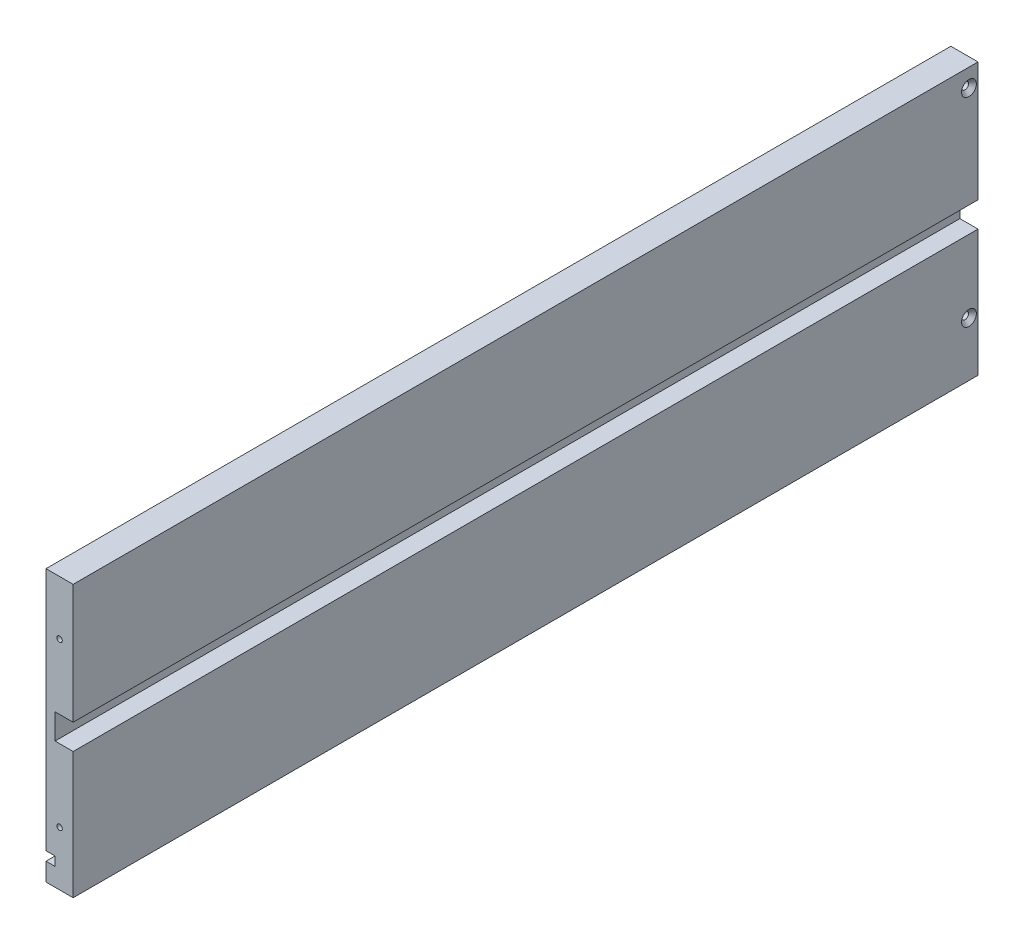
from build123d import *

# Parameters (mm, degrees)
SKETCH2_W                                         = 500
SKETCH2_H                                         = 150
BASE_EXTRUDE_DEPTH                                = 15
SKETCH3_W                                         = 10
SKETCH3_H                                         = 14
CUT_EXTRUDE1_DEPTH                                = 523.230791892
SKETCH4_W                                         = 5
SKETCH4_H                                         = 5
CUT_EXTRUDE2_DEPTH                                = 523.230791892
CSK_FOR_M3_5_FLAT_HEAD_MACHINE_SCREW1_D           = 3.9
CSK_FOR_M3_5_FLAT_HEAD_MACHINE_SCREW1_CSINK_D     = 8.2
CSK_FOR_M3_5_FLAT_HEAD_MACHINE_SCREW1_CSINK_ANGLE = 90
M3_0_3_000000_DIAMETER_HOLE1_D                    = 3
M3_0_3_000000_DIAMETER_HOLE1_DEPTH                = 10
M3_0_3_000000_DIAMETER_HOLE1_TIP                  = 0.901290929


with BuildPart() as part:
    # Sketch2 → Base-Extrude (new body)
    with BuildSketch(Plane(origin=(0, 0, 0), x_dir=(0, 0, -1), z_dir=(1, 0, 0))):
        with Locations((250, 75)):
            Rectangle(SKETCH2_W, SKETCH2_H)
    extrude(amount=-BASE_EXTRUDE_DEPTH)

    # Sketch3 → Cut-Extrude1 (cut, through all)
    with BuildSketch(Plane.XY):
        with Locations((-5, 77)):
            Rectangle(SKETCH3_W, SKETCH3_H)
    extrude(amount=-CUT_EXTRUDE1_DEPTH, mode=Mode.SUBTRACT)

    # Sketch4 → Cut-Extrude2 (cut, through all)
    with BuildSketch(Plane.XY):
        with Locations((-12.5, 12.5)):
            Rectangle(SKETCH4_W, SKETCH4_H)
    extrude(amount=-CUT_EXTRUDE2_DEPTH, mode=Mode.SUBTRACT)

    # CSK for M3.5 Flat Head Machine Screw1 (through all)
    with Locations(Plane(origin=(0, 0, 0), x_dir=(0, 0, -1), z_dir=(1, 0, 0))):
        with Locations((495, 140), (495, 30)):
            CounterSinkHole(CSK_FOR_M3_5_FLAT_HEAD_MACHINE_SCREW1_D / 2, CSK_FOR_M3_5_FLAT_HEAD_MACHINE_SCREW1_CSINK_D / 2, counter_sink_angle=CSK_FOR_M3_5_FLAT_HEAD_MACHINE_SCREW1_CSINK_ANGLE)

    # M3.0 (3.000000) Diameter Hole1
    with Locations(Plane.XY):
        with Locations((-7.5, 30), (-7.5, 120)):
            Hole(M3_0_3_000000_DIAMETER_HOLE1_D / 2, depth=M3_0_3_000000_DIAMETER_HOLE1_DEPTH)
            with Locations((0, 0, -(M3_0_3_000000_DIAMETER_HOLE1_DEPTH + M3_0_3_000000_DIAMETER_HOLE1_TIP / 2))):  # 118° drill point
                Cone(0, M3_0_3_000000_DIAMETER_HOLE1_D / 2, M3_0_3_000000_DIAMETER_HOLE1_TIP, mode=Mode.SUBTRACT)


solid = part.part
